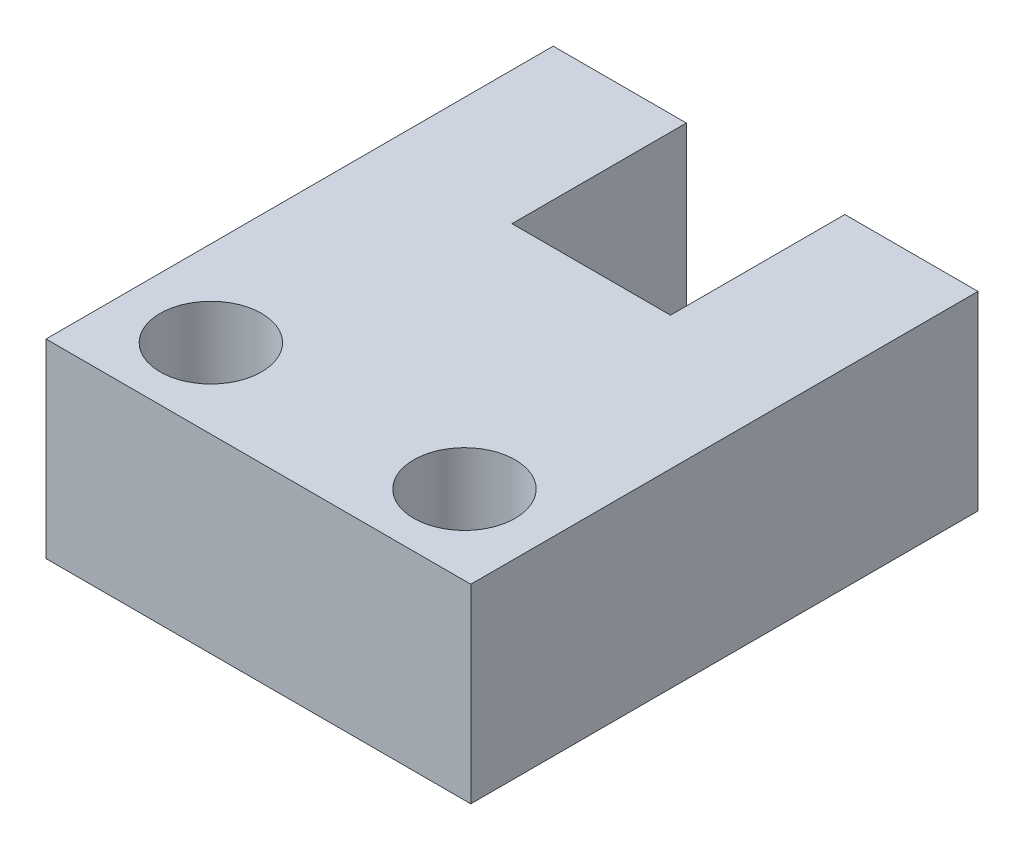
from build123d import *

# Parameters (mm, degrees)
SKETCH_1_R      = 1.6
EXTRUDE_1_DEPTH = 6


with BuildPart() as part:
    # 草图1 → 凸台-拉伸1 (new body)
    with BuildSketch(Plane(origin=(0, 0, 0), x_dir=(1, 0, 0), z_dir=(0, 1, 0))):
        Polygon((-6.7, 8), (-2.5, 8), (-2.5, 2.5), (2.5, 2.5), (2.5, 8), (6.7, 8), (6.7, -8), (-6.7, -8), align=None)
        with Locations(Location((4, -5.5, 0), (0, 0, 270))):
            Circle(SKETCH_1_R, mode=Mode.SUBTRACT)
        with Locations(Location((-4, -5.5, 0), (0, 0, 90))):
            Circle(SKETCH_1_R, mode=Mode.SUBTRACT)
    extrude(amount=EXTRUDE_1_DEPTH)


solid = part.part
